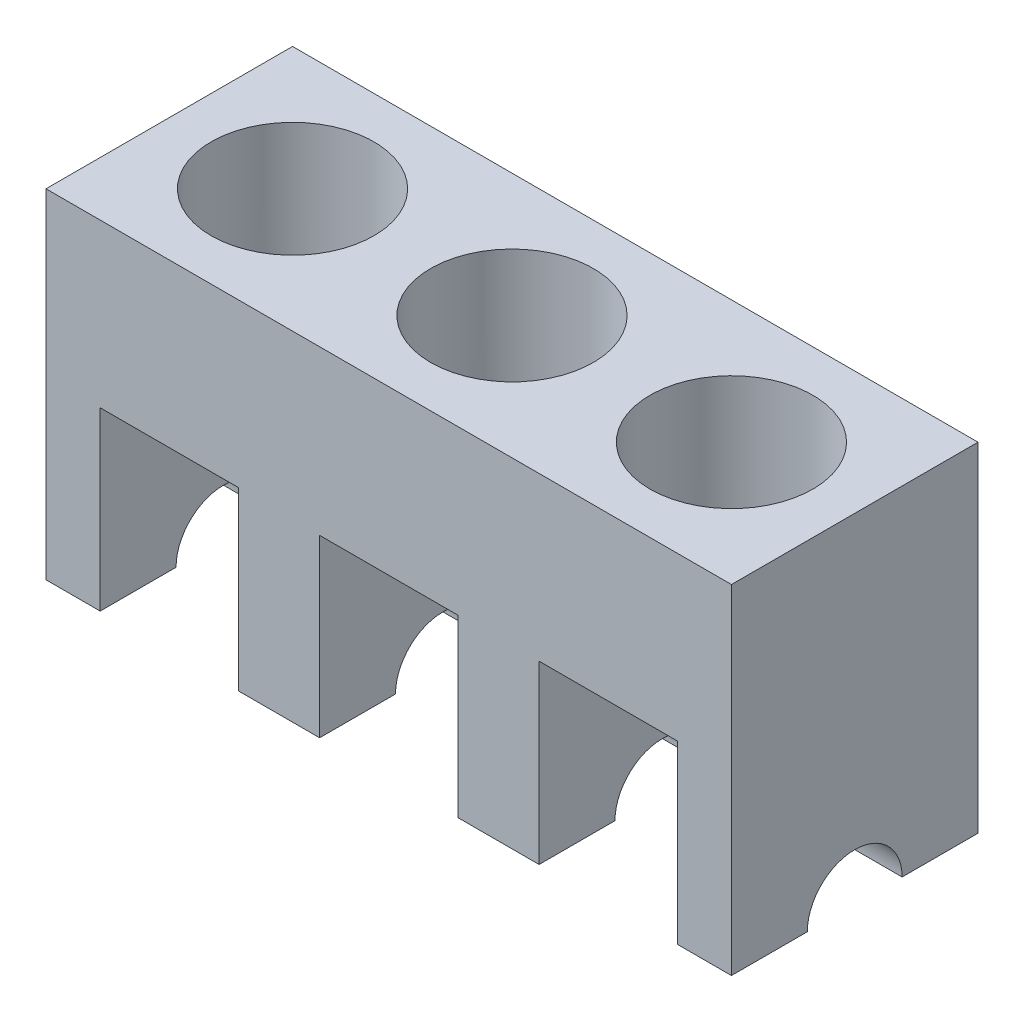
from build123d import *

# Parameters (mm, degrees)
SKETCH1_W               = 6426.2
SKETCH1_H               = 2311.4
BOSS_EXTRUDE1_DEPTH     = 3175
SKETCH2_R               = 763.27
CUT_EXTRUDE1_DEPTH      = 2057.4
CUT_EXTRUDE3_DEPTH      = 7475.536972742
CUT_EXTRUDE3_DEPTH_BACK = 7475.536972742
SKETCH6_W               = 1295.4
SKETCH6_H               = 1651
CUT_EXTRUDE4_DEPTH      = 7523.97968682
CUT_EXTRUDE4_DEPTH_BACK = 7523.97968682
SKETCH7_R               = 444.5
SCALE1_SCALE            = 0.039370079


with BuildPart() as part:
    # Sketch1 → Boss-Extrude1 (new body)
    with BuildSketch(Plane(origin=(0, 0, 0), x_dir=(1, 0, 0), z_dir=(0, 1, 0))):
        with Locations((3156.321169036, 1128.715007899)):
            Rectangle(SKETCH1_W, SKETCH1_H)
    extrude(amount=BOSS_EXTRUDE1_DEPTH)

    # Sketch2 → Cut-Extrude1 (cut)
    with BuildSketch(Plane(origin=(0, 3175, 0), x_dir=(1, 0, 0), z_dir=(0, 1, 0))):
        with Locations(Location((1098.921169036, 1128.715007899, 0), (0, 0, 270))):
            Circle(SKETCH2_R)
        with Locations(Location((3156.321169036, 1128.715007899, 0), (0, 0, 270))):
            Circle(SKETCH2_R)
        with Locations(Location((5213.721169036, 1128.715007899, 0), (0, 0, 270))):
            Circle(SKETCH2_R)
    extrude(amount=-CUT_EXTRUDE1_DEPTH, mode=Mode.SUBTRACT)

    # Sketch6 → Cut-Extrude3 (cut, two sides: drawn at the far end of the back side and taken through both)
    with BuildSketch(Plane.XY.offset(-CUT_EXTRUDE3_DEPTH_BACK)):
        with Locations((3156.321169036, 818.341718397)):
            Rectangle(SKETCH6_W, SKETCH6_H)
        with Locations((5213.721169036, 825.5)):
            Rectangle(SKETCH6_W, SKETCH6_H)
        with Locations((1098.921169036, 825.5)):
            Rectangle(SKETCH6_W, SKETCH6_H)
    extrude(amount=CUT_EXTRUDE3_DEPTH + CUT_EXTRUDE3_DEPTH_BACK, mode=Mode.SUBTRACT)

    # Sketch7 → Cut-Extrude4 (cut, two sides: drawn at the far end of the back side and taken through both)
    with BuildSketch(Plane(origin=(6369.421169036, 0, 0), x_dir=(0, 0, -1), z_dir=(1, 0, 0)).offset(-CUT_EXTRUDE4_DEPTH_BACK)):
        with Locations((1128.715007899, 0)):
            Circle(SKETCH7_R)
    extrude(amount=CUT_EXTRUDE4_DEPTH + CUT_EXTRUDE4_DEPTH_BACK, mode=Mode.SUBTRACT)


with BuildPart() as part_1:
    # Scale1: scaled about (0, 0, 0)
    add(part.part.scale(SCALE1_SCALE))


solid = part_1.part
